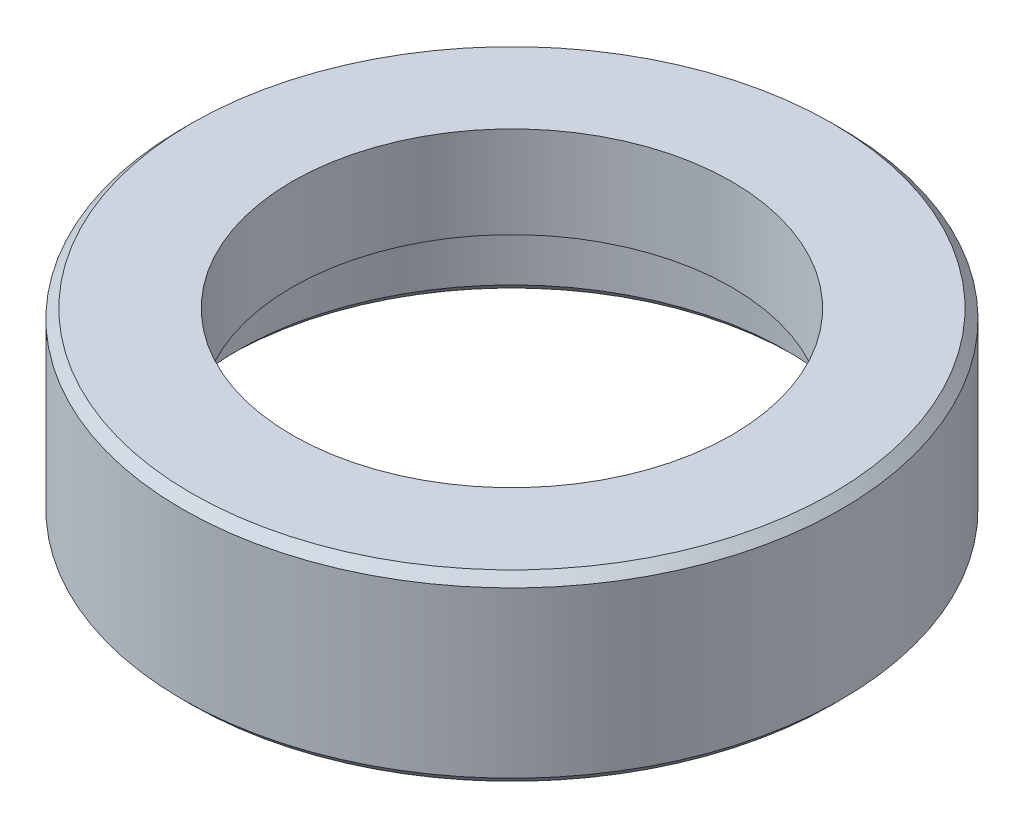
from build123d import *

# Parameters (mm, degrees)
SKETCH1_R           = 9
BOSS_EXTRUDE1_DEPTH = 5
SKETCH1_3_R         = 6
CUT_EXTRUDE1_DEPTH  = 5
SKETCH1_4_R         = 7.5
SKETCH1_4_R_2       = 6
CUT_EXTRUDE2_DEPTH  = 2.5
CHAMFER1_SIZE       = 0.25


with BuildPart() as part:
    # Sketch1 → Boss-Extrude1 (new body)
    with BuildSketch(Plane(origin=(0, 0, 0), x_dir=(1, 0, 0), z_dir=(0, 1, 0))):
        with Locations(Location((0, 0, 0), (0, 0, 270))):
            Circle(SKETCH1_R)
    extrude(amount=BOSS_EXTRUDE1_DEPTH)

    # Sketch1<3> → Cut-Extrude1 (cut)
    with BuildSketch(Plane(origin=(0, 0, 0), x_dir=(1, 0, 0), z_dir=(0, 1, 0))):
        with Locations(Location((0, 0, 0), (0, 0, 270))):
            Circle(SKETCH1_3_R)
    extrude(amount=CUT_EXTRUDE1_DEPTH, mode=Mode.SUBTRACT)

    # Sketch1<4> → Cut-Extrude2 (cut)
    with BuildSketch(Plane(origin=(0, 0, 0), x_dir=(1, 0, 0), z_dir=(0, 1, 0))):
        with Locations(Location((0, 0, 0), (0, 0, 270))):
            Circle(SKETCH1_4_R)
        with Locations(Location((0, 0, 0), (0, 0, 270))):
            Circle(SKETCH1_4_R_2, mode=Mode.SUBTRACT)
    extrude(amount=CUT_EXTRUDE2_DEPTH, mode=Mode.SUBTRACT)

    # Chamfer1
    chamfer1_edges = [part.edges().sort_by_distance(p)[0] for p in [
        (0, 0, -7.5),
        (0, 0, -9),
        (0, 5, -9),
    ]]
    chamfer(chamfer1_edges, length=CHAMFER1_SIZE)


solid = part.part
